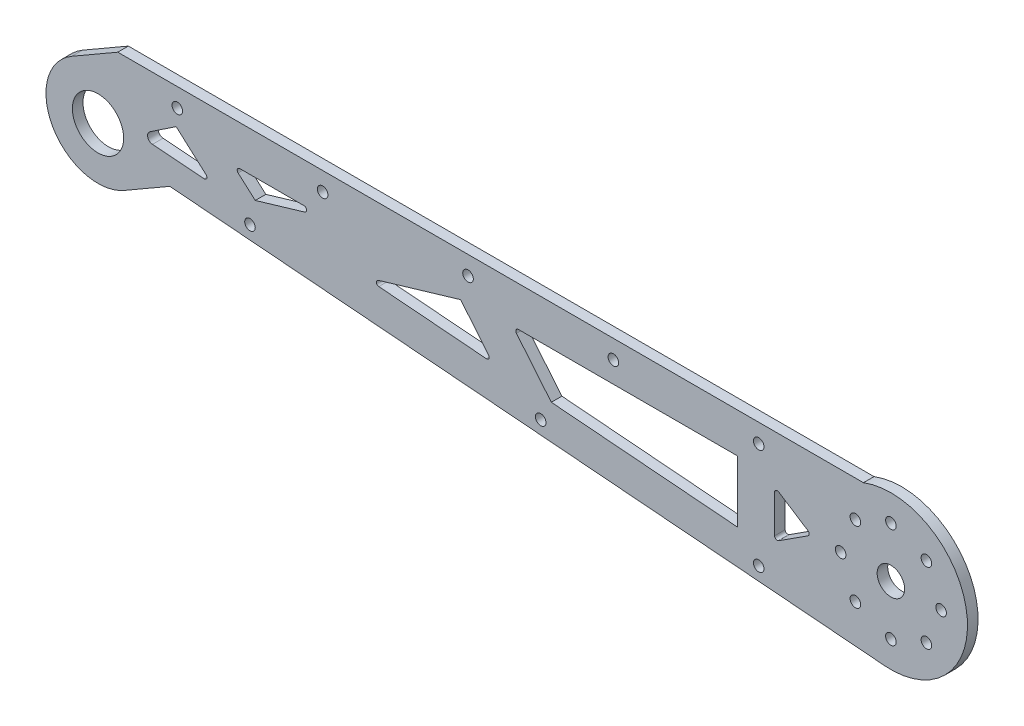
from build123d import *

# Parameters (mm, degrees)
SKETCH_1_R          = 9.7
SKETCH_1_R_2        = 5.2
SKETCH_1_R_3        = 2
EXTRUDE_1_DEPTH     = 4
CUT_EXTRUDE_1_DEPTH = 10


with BuildPart() as part:
    # 草图1 → 凸台-拉伸1 (new body)
    with BuildSketch(Plane.XY):
        with BuildLine():
            Line((-9.85, 17.060700455), (7.470508076, 27.060700455))
            Line((7.470508076, 27.060700455), (289.624667154, 27.060700455))
            ThreePointArc((289.624667154, 27.060700455), (328.694852344, 4.11311011), (297.66555963, -28.905888469))
            Line((297.66555963, -28.905888469), (27.170508076, -7.060700455))
            Line((27.170508076, -7.060700455), (9.85, -17.060700455))
            ThreePointArc((9.85, -17.060700455), (-17.060700455, -9.85), (-9.85, 17.060700455))
        make_face()
        Circle(SKETCH_1_R, mode=Mode.SUBTRACT)
        with Locations((300, 0)):
            Circle(SKETCH_1_R_2, mode=Mode.SUBTRACT)
        with Locations((319, 0)):
            Circle(SKETCH_1_R_3, mode=Mode.SUBTRACT)
        with Locations((313.435028843, -13.435028843)):
            Circle(SKETCH_1_R_3, mode=Mode.SUBTRACT)
        with Locations((300, -19)):
            Circle(SKETCH_1_R_3, mode=Mode.SUBTRACT)
        with Locations((286.564971157, -13.435028843)):
            Circle(SKETCH_1_R_3, mode=Mode.SUBTRACT)
        with Locations((281, 0)):
            Circle(SKETCH_1_R_3, mode=Mode.SUBTRACT)
        with Locations((286.564971157, 13.435028843)):
            Circle(SKETCH_1_R_3, mode=Mode.SUBTRACT)
        with Locations((300, 19)):
            Circle(SKETCH_1_R_3, mode=Mode.SUBTRACT)
        with Locations((313.435028843, 13.435028843)):
            Circle(SKETCH_1_R_3, mode=Mode.SUBTRACT)
        with Locations((250, 20)):
            Circle(SKETCH_1_R_3, mode=Mode.SUBTRACT)
        with Locations((195, 20)):
            Circle(SKETCH_1_R_3, mode=Mode.SUBTRACT)
        with Locations((140, 20)):
            Circle(SKETCH_1_R_3, mode=Mode.SUBTRACT)
        with Locations((85, 20)):
            Circle(SKETCH_1_R_3, mode=Mode.SUBTRACT)
        with Locations((30, 20)):
            Circle(SKETCH_1_R_3, mode=Mode.SUBTRACT)
        with Locations(Location((250, -20, 0), (0, 0, 180))):
            Circle(SKETCH_1_R_3, mode=Mode.SUBTRACT)
        with Locations((167.5, -13.337297667)):
            Circle(SKETCH_1_R_3, mode=Mode.SUBTRACT)
        with Locations((57.5, -4.453694555)):
            Circle(SKETCH_1_R_3, mode=Mode.SUBTRACT)
    extrude(amount=EXTRUDE_1_DEPTH)

    # 草图2 → 切除-拉伸1 (cut)
    with BuildSketch(Plane(origin=(0, 0, 0), x_dir=(-1, 0, 0), z_dir=(0, 0, -1))):
        with BuildLine():
            Line((-137.197603441, 10.82531174), (-106.043706264, 1.591034337))
            ThreePointArc((-106.043706264, 1.591034337), (-105.333274422, 0.528665045), (-106.247395472, -0.364489265))
            Line((-106.247395472, -0.364489265), (-146.939942745, -3.650820533))
            ThreePointArc((-146.939942745, -3.650820533), (-147.907056702, -3.116572023), (-147.791851116, -2.017727835))
            Line((-147.791851116, -2.017727835), (-137.197603441, 10.82531174))
        make_face()
        with BuildLine():
            Line((-242, 12), (-159.091058121, 12))
            ThreePointArc((-159.091058121, 12), (-158.186531194, 11.426416508), (-158.319647694, 10.363662077))
            Line((-158.319647694, 10.363662077), (-171.517559676, -5.635709572))
            Line((-171.517559676, -5.635709572), (-242, -11.327873446))
            Line((-242, -11.327873446), (-242, 12))
        make_face()
        with BuildLine():
            Line((-77.967218715, 12), (-53.665101582, 12))
            ThreePointArc((-53.665101582, 12), (-52.730413268, 11.355468359), (-53.000597339, 10.252715509))
            Line((-53.000597339, 10.252715509), (-59.49167188, 4.480688084))
            Line((-59.49167188, 4.480688084), (-78.251405867, 10.041231173))
            ThreePointArc((-78.251405867, 10.041231173), (-78.956857242, 11.14358129), (-77.967218715, 12))
        make_face()
        with BuildLine():
            Line((-268.630020148, 0.840296648), (-257.54212687, 7.993776182))
            ThreePointArc((-257.54212687, 7.993776182), (-256.52152684, 8.031581712), (-256, 7.153479534))
            Line((-256, 7.153479534), (-256, -7.153479534))
            ThreePointArc((-256, -7.153479534), (-256.52152684, -8.031581712), (-257.54212687, -7.993776182))
            Line((-257.54212687, -7.993776182), (-268.630020148, -0.840296648))
            ThreePointArc((-268.630020148, -0.840296648), (-269.087893278, 0), (-268.630020148, 0.840296648))
        make_face()
        with BuildLine():
            Line((-19.631707517, 7.078552885), (-29.56189752, 13.698679554))
            Line((-29.56189752, 13.698679554), (-40.860283753, 3.651869157))
            ThreePointArc((-40.860283753, 3.651869157), (-41.116034111, 2.513264507), (-40.118555254, 1.907570918))
            Line((-40.118555254, 1.907570918), (-20.586659398, 3.4204248))
            ThreePointArc((-20.586659398, 3.4204248), (-18.805958358, 4.909282805), (-19.631707517, 7.078552885))
        make_face()
    extrude(amount=-CUT_EXTRUDE_1_DEPTH, mode=Mode.SUBTRACT)


solid = part.part
